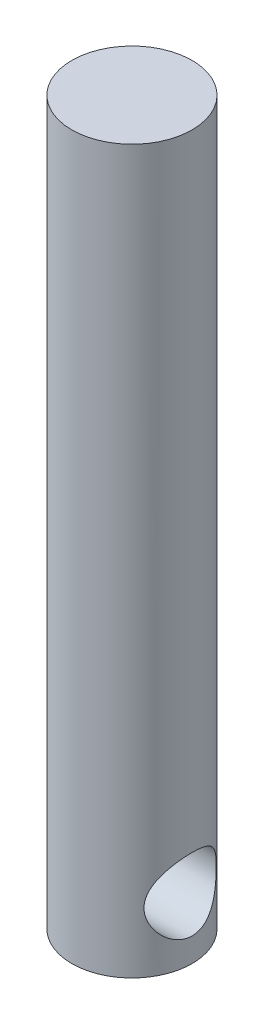
from build123d import *

# Parameters (mm, degrees)
SKETCH1_R               = 2.5
BOSS_EXTRUDE1_DEPTH     = 30
CUT_EXTRUDE1_DEPTH      = 31.207614934
CUT_EXTRUDE1_DEPTH_BACK = 31.207614934
SKETCH2_R               = 1.5


with BuildPart() as part:
    # Sketch1 → Boss-Extrude1 (new body)
    with BuildSketch(Plane(origin=(0, 0, 0), x_dir=(1, 0, 0), z_dir=(0, 1, 0))):
        with Locations(Location((0, 0, 0), (0, 0, 270))):
            Circle(SKETCH1_R)
    extrude(amount=BOSS_EXTRUDE1_DEPTH)

    # Sketch2 → Cut-Extrude1 (cut, two sides: drawn at the far end of the back side and taken through both)
    with BuildSketch(Plane(origin=(0, 0, 0), x_dir=(0, 0, -1), z_dir=(1, 0, 0)).offset(-CUT_EXTRUDE1_DEPTH_BACK)):
        with Locations((0, 2.5)):
            Circle(SKETCH2_R)
    extrude(amount=CUT_EXTRUDE1_DEPTH + CUT_EXTRUDE1_DEPTH_BACK, mode=Mode.SUBTRACT)


solid = part.part
